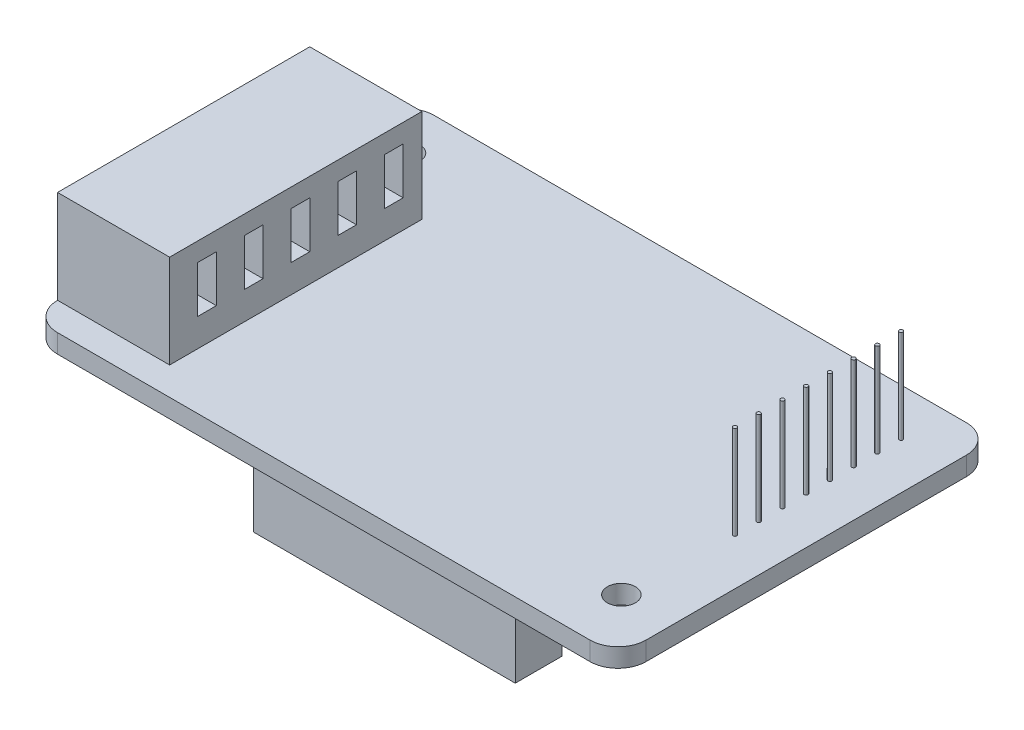
from build123d import *

# Parameters (mm, degrees)
SKETCH_1_W             = 63
SKETCH_1_H             = 40.3
EXTRUDE_1_DEPTH        = 2
CUT_EXTRUDE_1_REACH    = 39.447
SKETCH_2_R             = 1.5
FILLET_1_R             = 3
SKETCH_3_W             = 41
SKETCH_3_H             = 5
SKETCH_3_W_2           = 28
EXTRUDE_2_DEPTH        = 10
SKETCH_4_W             = 12
SKETCH_4_H             = 27
EXTRUDE_3_DEPTH        = 10
CUT_EXTRUDE_2_REACH    = 69.224
SKETCH_5_W             = 2
SKETCH_5_H             = 5
PATTERN_LINEAR_1_COUNT = 5
PATTERN_LINEAR_1_PITCH = 5
SKETCH_6_R             = 0.2
EXTRUDE_4_DEPTH        = 10
PATTERN_LINEAR_2_COUNT = 8
PATTERN_LINEAR_2_PITCH = 2.54


with BuildPart() as part:
    # 草图1 → 凸台-拉伸1 (new body)
    with BuildSketch(Plane(origin=(0, 0, 0), x_dir=(1, 0, 0), z_dir=(0, 1, 0))):
        Rectangle(SKETCH_1_W, SKETCH_1_H)
    extrude(amount=EXTRUDE_1_DEPTH)

    # 草图2 → 切除-拉伸1 (cut, up to next)
    with BuildSketch(Plane(origin=(0, 2, 0), x_dir=(1, 0, 0), z_dir=(0, 1, 0)), mode=Mode.PRIVATE) as cut_extrude_1_sk1:
        with Locations(Location((-26.5, 15.15, 0), (0, 0, 270))):
            Circle(SKETCH_2_R)
    cut_extrude_1_tool1 = extrude(cut_extrude_1_sk1.sketch, amount=-CUT_EXTRUDE_1_REACH, mode=Mode.PRIVATE) & part.part
    # 草图2 → 切除-拉伸1 (cut, up to next)
    with BuildSketch(Plane(origin=(0, 2, 0), x_dir=(1, 0, 0), z_dir=(0, 1, 0)), mode=Mode.PRIVATE) as cut_extrude_1_sk2:
        with Locations(Location((25.98, -14.27, 0), (0, 0, 270))):
            Circle(SKETCH_2_R)
    cut_extrude_1_tool2 = extrude(cut_extrude_1_sk2.sketch, amount=-CUT_EXTRUDE_1_REACH, mode=Mode.PRIVATE) & part.part
    add(cut_extrude_1_tool1.solids().sort_by_distance((-26.5, 2, -15.15))[0], mode=Mode.SUBTRACT)
    add(cut_extrude_1_tool2.solids().sort_by_distance((25.98, 2, 14.27))[0], mode=Mode.SUBTRACT)

    # 圆角1
    fillet_1_edges = [part.edges().sort_by_distance(p)[0] for p in [
        (31.5, 1, 20.15),
        (-31.5, 1, 20.15),
        (-31.5, 1, -20.15),
        (31.5, 1, -20.15),
    ]]
    fillet(fillet_1_edges, radius=FILLET_1_R)

    # 草图3 → 凸台-拉伸2 (add)
    with BuildSketch(Plane(origin=(0, 0, 0), x_dir=(-1, 0, 0), z_dir=(0, -1, 0))):
        with Locations((0, 13.65)):
            Rectangle(SKETCH_3_W, SKETCH_3_H)
        with Locations((-2.5, -13.65)):
            Rectangle(SKETCH_3_W_2, SKETCH_3_H)
    extrude(amount=EXTRUDE_2_DEPTH)

    # 草图4 → 凸台-拉伸3 (add)
    with BuildSketch(Plane(origin=(0, 2, 0), x_dir=(1, 0, 0), z_dir=(0, 1, 0))):
        with Locations((-25.5, -3.65)):
            Rectangle(SKETCH_4_W, SKETCH_4_H)
    extrude(amount=EXTRUDE_3_DEPTH)

    # 草图5 → 切除-拉伸2 (cut, up to next)
    with BuildSketch(Plane.ZY.offset(31.5), mode=Mode.PRIVATE) as cut_extrude_2_sk1:
        with Locations((-6.85, 7.5)):
            Rectangle(SKETCH_5_W, SKETCH_5_H)
    cut_extrude_2_tool1 = extrude(cut_extrude_2_sk1.sketch, amount=-CUT_EXTRUDE_2_REACH, mode=Mode.PRIVATE) & part.part
    cut_extrude_2 = cut_extrude_2_tool1.solids().sort_by_distance((-31.5, 7.5, -6.85))[0]
    add(cut_extrude_2, mode=Mode.SUBTRACT)

    # 阵列(线性)1: 切除-拉伸2 ×5
    with Locations(*[(0, 0, i * PATTERN_LINEAR_1_PITCH) for i in range(1, PATTERN_LINEAR_1_COUNT)]):
        add(cut_extrude_2, mode=Mode.SUBTRACT)

    # 草图6 → 凸台-拉伸4 (add)
    with BuildSketch(Plane(origin=(0, 2, 0), x_dir=(1, 0, 0), z_dir=(0, 1, 0))):
        with Locations(Location((26.5, 15.15, 0), (0, 0, 90))):
            Circle(SKETCH_6_R)
    extrude_4 = extrude(amount=EXTRUDE_4_DEPTH)

    # 阵列(线性)2: 凸台-拉伸4 ×8
    with Locations(*[(0, 0, i * PATTERN_LINEAR_2_PITCH) for i in range(1, PATTERN_LINEAR_2_COUNT)]):
        add(extrude_4)


solid = part.part
